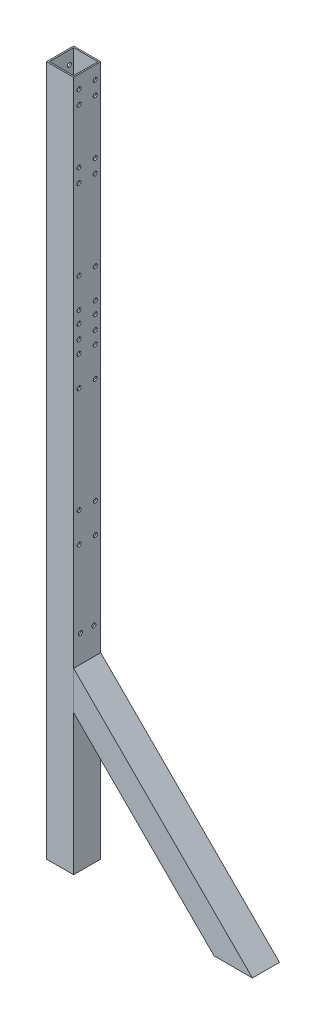
from build123d import *

# Parameters (mm, degrees)
HS_20X20X1_1_DEPTH        = 520
HS_20X20X1_1_DEPTH_BACK   = 10
SKETCH_1_W                = 20
SKETCH_1_H                = 20
SKETCH_1_W_2              = 18
SKETCH_1_H_2              = 18
SKETCH_1_ON_SEGMENT_2_W   = 20
SKETCH_1_ON_SEGMENT_2_H   = 20
SKETCH_1_ON_SEGMENT_2_W_2 = 18
SKETCH_1_ON_SEGMENT_2_H_2 = 18
HS_20X20X1_1_2_DEPTH      = 210.142135624
SKETCH_1_ON_SEGMENT_3_W   = 20
SKETCH_1_ON_SEGMENT_3_H   = 20
SKETCH_1_ON_SEGMENT_3_W_2 = 18
SKETCH_1_ON_SEGMENT_3_H_2 = 18
HS_20X20X1_1_3_DEPTH      = 101
SKETCH_2_W                = 110
SKETCH_2_H                = 20
CUT_EXTRUDE_1_DEPTH       = 41
SKETCH_5_R                = 1.5
CUT_EXTRUDE_3_DEPTH       = 41
SKETCH_6_R                = 1.5
CUT_EXTRUDE_4_DEPTH       = 31
SKETCH_7_W                = 205.407074521
SKETCH_7_H                = 37.648309167
CUT_EXTRUDE_5_DEPTH       = 541.196723426
SKETCH_8_R                = 1.5
CUT_EXTRUDE_6_DEPTH       = 537.592379448


with BuildPart() as part:
    # 草图1 → Hs 20X20X1(1) (new, two sides: drawn at the far end of the back side and taken through both)
    with BuildSketch(Plane(origin=(0, 0, 0), x_dir=(1, 0, 0), z_dir=(0, 1, 0)).offset(-HS_20X20X1_1_DEPTH_BACK)):
        Rectangle(SKETCH_1_W, SKETCH_1_H)
        Rectangle(SKETCH_1_W_2, SKETCH_1_H_2, mode=Mode.SUBTRACT)
    extrude(amount=HS_20X20X1_1_DEPTH + HS_20X20X1_1_DEPTH_BACK)


with BuildPart() as body_2:
    # 草图1 on segment 2 (carried to segment 2) → Hs 20X20X1_1 2 (new body)
    with BuildSketch(Plane(origin=(-10.707106781, 148.592929113, 0), x_dir=(-0.707106781, -0.707106781, 0), z_dir=(0.707106781, -0.707106781, 0))):
        Rectangle(SKETCH_1_ON_SEGMENT_2_W, SKETCH_1_ON_SEGMENT_2_H)
        Rectangle(SKETCH_1_ON_SEGMENT_2_W_2, SKETCH_1_ON_SEGMENT_2_H_2, mode=Mode.SUBTRACT)
    extrude(amount=HS_20X20X1_1_2_DEPTH)

    # Hs 20X20X1_1 2 end butt 1
    split(bisect_by=Plane(origin=(10, 137.885822331, 0), x_dir=(0, 1, 0), z_dir=(1, 0, 0)), keep=Keep.TOP)

    # 草图7 → 切除-拉伸5 (cut, through all)
    with BuildSketch(Plane.XY.offset(10)):
        with Locations((92.70353726, -8.824154584)):
            Rectangle(SKETCH_7_W, SKETCH_7_H)
    extrude(amount=-CUT_EXTRUDE_5_DEPTH, mode=Mode.SUBTRACT)


with BuildPart() as body_3:
    # 草图1 on segment 3 (carried to segment 3) → Hs 20X20X1_1 3 (new body)
    with BuildSketch(Plane(origin=(-1, 0, 0), x_dir=(0, -1, 0), z_dir=(1, 0, 0))):
        Rectangle(SKETCH_1_ON_SEGMENT_3_W, SKETCH_1_ON_SEGMENT_3_H)
        Rectangle(SKETCH_1_ON_SEGMENT_3_W_2, SKETCH_1_ON_SEGMENT_3_H_2, mode=Mode.SUBTRACT)
    extrude(amount=HS_20X20X1_1_3_DEPTH)

    # Hs 20X20X1_1 3 end butt 1
    split(bisect_by=Plane.YZ.offset(10), keep=Keep.TOP)


with BuildPart() as cut_extrude_1_tool:
    # 草图2 → 切除-拉伸1 (new body)
    with BuildSketch(Plane.XY.offset(10)):
        with Locations((45, 0)):
            Rectangle(SKETCH_2_W, SKETCH_2_H)
    extrude(amount=-CUT_EXTRUDE_1_DEPTH)


with BuildPart() as part_1:
    add(part.part)

    # 切除-拉伸1: cut by cut_extrude_1_tool
    add(cut_extrude_1_tool.part, mode=Mode.SUBTRACT)

    # 草图5 → 切除-拉伸3 (cut)
    with BuildSketch(Plane(origin=(10, 0, 0), x_dir=(0, 0, -1), z_dir=(1, 0, 0))):
        with Locations((5, 162)):
            Circle(SKETCH_5_R)
        with Locations((-5, 162)):
            Circle(SKETCH_5_R)
    extrude(amount=-CUT_EXTRUDE_3_DEPTH, mode=Mode.SUBTRACT)

    # 草图6 → 切除-拉伸4 (cut)
    with BuildSketch(Plane(origin=(10, 0, 0), x_dir=(0, 0, -1), z_dir=(1, 0, 0))):
        with Locations((-6, 369.17190339)):
            Circle(SKETCH_6_R)
        with Locations((6, 369.17190339)):
            Circle(SKETCH_6_R)
        with Locations((-6, 391.17190339)):
            Circle(SKETCH_6_R)
        with Locations((6, 391.17190339)):
            Circle(SKETCH_6_R)
        with Locations((-6.05, 510.42190339)):
            Circle(SKETCH_6_R)
        with Locations((-6.05, 500.42190339)):
            Circle(SKETCH_6_R)
        with Locations((5.95, 500.42190339)):
            Circle(SKETCH_6_R)
        with Locations((5.95, 510.42190339)):
            Circle(SKETCH_6_R)
    extrude(amount=-CUT_EXTRUDE_4_DEPTH, mode=Mode.SUBTRACT)

    # 草图8 → 切除-拉伸6 (cut, through all)
    with BuildSketch(Plane(origin=(10, 0, 0), x_dir=(0, 0, -1), z_dir=(1, 0, 0))):
        with Locations((6.037156755, 219.171907992)):
            Circle(SKETCH_8_R)
        with Locations((-5.962843245, 219.171907992)):
            Circle(SKETCH_8_R)
        with Locations((6.037156755, 241.171907992)):
            Circle(SKETCH_8_R)
        with Locations((-5.962843245, 241.171907992)):
            Circle(SKETCH_8_R)
        with Locations((5.987156755, 350.421907992)):
            Circle(SKETCH_8_R)
        with Locations((-6.012843245, 350.421907992)):
            Circle(SKETCH_8_R)
        with Locations((5.987156755, 360.421907992)):
            Circle(SKETCH_8_R)
        with Locations((-6.012843245, 360.421907992)):
            Circle(SKETCH_8_R)
        with Locations((5.955402523, 319.171874574)):
            Circle(SKETCH_8_R)
        with Locations((-6.044597477, 319.171874574)):
            Circle(SKETCH_8_R)
        with Locations((5.955402523, 341.171874574)):
            Circle(SKETCH_8_R)
        with Locations((-6.044597477, 341.171874574)):
            Circle(SKETCH_8_R)
        with Locations((5.905402523, 450.421874574)):
            Circle(SKETCH_8_R)
        with Locations((-6.094597477, 450.421874574)):
            Circle(SKETCH_8_R)
        with Locations((5.905402523, 460.421874574)):
            Circle(SKETCH_8_R)
        with Locations((-6.094597477, 460.421874574)):
            Circle(SKETCH_8_R)
    extrude(amount=-CUT_EXTRUDE_6_DEPTH, mode=Mode.SUBTRACT)


with BuildPart() as body_3_1:
    add(body_3.part)

    # 切除-拉伸1: cut by cut_extrude_1_tool
    add(cut_extrude_1_tool.part, mode=Mode.SUBTRACT)


solid = Compound([body_2.part, part_1.part])
